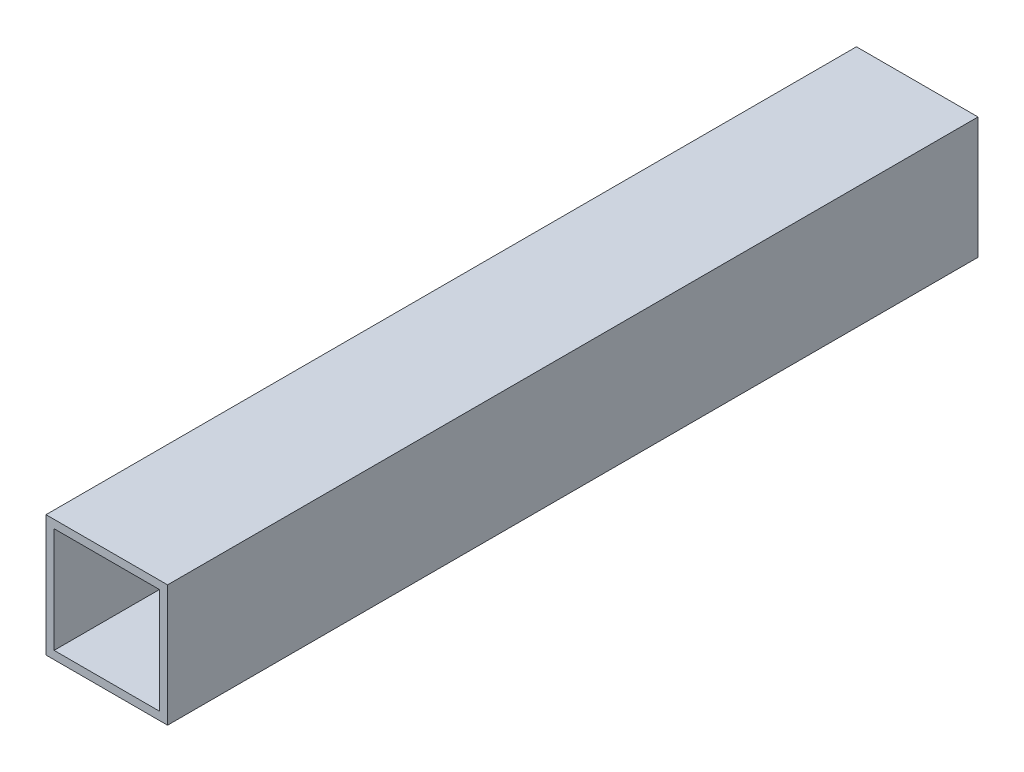
from build123d import *

# Parameters (mm, degrees)
SKETCH_1_W      = 15
SKETCH_1_H      = 15
SKETCH_1_W_2    = 13
SKETCH_1_H_2    = 13
EXTRUDE_1_DEPTH = 100


with BuildPart() as part:
    # 草图1 → 拉伸-薄壁1 (new body)
    with BuildSketch(Plane.XY):
        with Locations((7.5, -7.5)):
            Rectangle(SKETCH_1_W, SKETCH_1_H)
        with Locations((7.5, -7.5)):
            Rectangle(SKETCH_1_W_2, SKETCH_1_H_2, mode=Mode.SUBTRACT)
    extrude(amount=EXTRUDE_1_DEPTH)


solid = part.part
